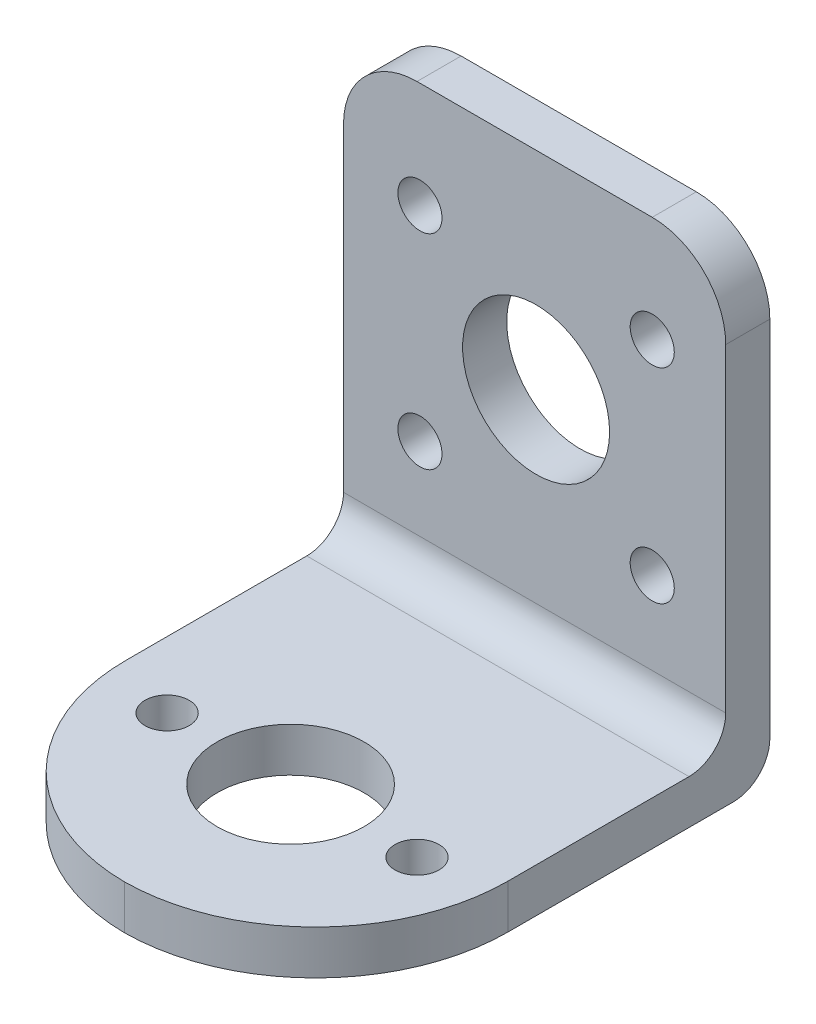
from build123d import *

# Parameters (mm, degrees)
BOSS_EXTRUDE1_DEPTH        = 3
SKETCH2_W                  = 26
SKETCH2_H                  = 3
BOSS_EXTRUDE2_DEPTH        = 29.2
F_10_0_10_DIAMETER_HOLE1_D = 10
F_3_0_3_DIAMETER_HOLE1_D   = 3
F_10_0_10_DIAMETER_HOLE2_D = 10
F_3_0_3_DIAMETER_HOLE2_D   = 3
FILLET1_R                  = 2.5
FILLET3_R                  = 5


with BuildPart() as part:
    # Sketch1 → Boss-Extrude1 (new body)
    with BuildSketch(Plane(origin=(0, -13.75, 0), x_dir=(1, 0, 0), z_dir=(0, 1, 0))):
        with BuildLine():
            Line((13.000000223, -17.8), (13.000000223, 0))
            Line((13.000000223, 0), (-13, 0))
            Line((-13, 0), (-13, -17.8))
            ThreePointArc((-13, -17.8), (-9.198386918, -27.027675803), (1.11e-07, -30.899618316))
            ThreePointArc((1.11e-07, -30.899618316), (9.19838714, -27.027675803), (13.000000223, -17.8))
        make_face()
    extrude(amount=-BOSS_EXTRUDE1_DEPTH)

    # Sketch2 → Boss-Extrude2 (add)
    with BuildSketch(Plane(origin=(0, -13.75, 0), x_dir=(-1, 0, 0), z_dir=(0, 1, 0))):
        with Locations((0, 1.5)):
            Rectangle(SKETCH2_W, SKETCH2_H)
    extrude(amount=BOSS_EXTRUDE2_DEPTH)

    # Ø10.0 (10) Diameter Hole1 (through all)
    with Locations(Plane(origin=(0, -13.75, 0), x_dir=(1, 0, 0), z_dir=(0, 1, 0))):
        with Locations((-0.099999806, -19.5)):
            Hole(F_10_0_10_DIAMETER_HOLE1_D / 2)

    # Ø3.0 (3) Diameter Hole1 (through all)
    with Locations(Plane(origin=(0, -13.75, 0), x_dir=(1, 0, 0), z_dir=(0, 1, 0))):
        with Locations((8.5, -19.5), (-8.5, -19.5)):
            Hole(F_3_0_3_DIAMETER_HOLE1_D / 2)

    # Ø10.0 (10) Diameter Hole2 (through all)
    with Locations(Plane.XY.offset(3)):
        with Locations((0.1, 1.35)):
            Hole(F_10_0_10_DIAMETER_HOLE2_D / 2)

    # Ø3.0 (3) Diameter Hole2 (through all)
    with Locations(Plane.XY.offset(3)):
        with Locations((-7.8, 8.25), (8, -5.65), (-7.8, -5.65), (8, 8.25)):
            Hole(F_3_0_3_DIAMETER_HOLE2_D / 2)

    # Fillet1
    fillet1_edges = [part.edges().sort_by_distance(p)[0] for p in [
        (1.11e-07, -16.75, 0),
        (0, -13.75, 3),
    ]]
    fillet(fillet1_edges, radius=FILLET1_R)

    # Fillet3
    fillet3_edges = [part.edges().sort_by_distance(p)[0] for p in [
        (13, 15.45, 1.5),
        (-13, 15.45, 1.5),
    ]]
    fillet(fillet3_edges, radius=FILLET3_R)


solid = part.part
